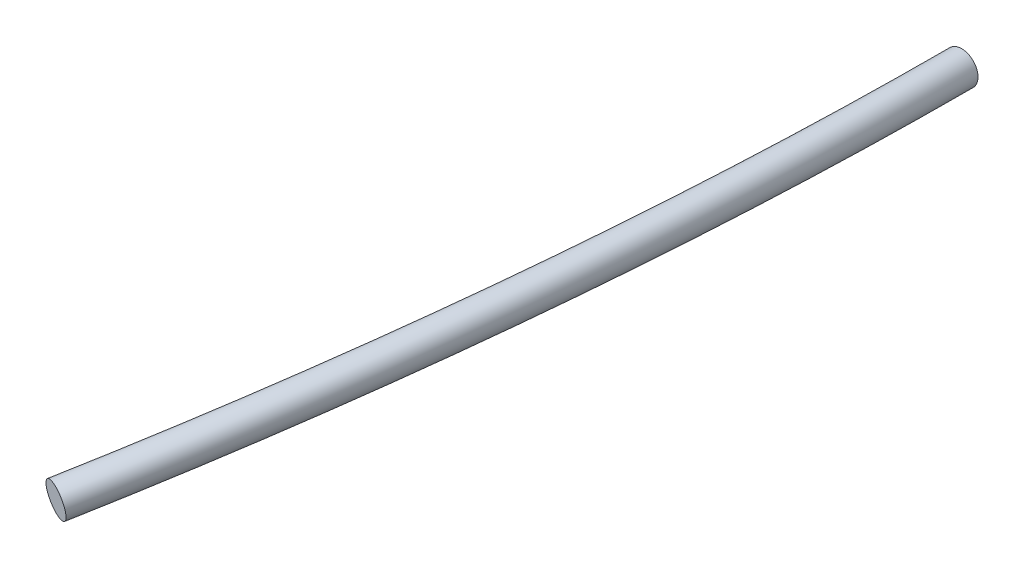
from build123d import *

# Parameters (mm, degrees)
SKETCH1_R = 50.8


with BuildPart() as part:
    # Sweep1: sweep along a path in Sketch2
    with BuildLine(Plane(origin=(-1887.371866274, 4268.729503733, 0), x_dir=(0.9145923982502304, 0.40437698384415033, 0), z_dir=(0.40437698384415033, -0.9145923982502304, 0))) as sweep1_path:
        ThreePointArc((6213.66000635, 0), (6093.498744721, 1211.268685614), (5737.698986577, 2375.320698906))
    # Sketch1 → Sweep1 (sweep)
    with BuildSketch(Plane.XY):
        with Locations((3795.594340845, 6781.390595734)):
            Circle(SKETCH1_R)
    sweep(path=sweep1_path.line)


solid = part.part
